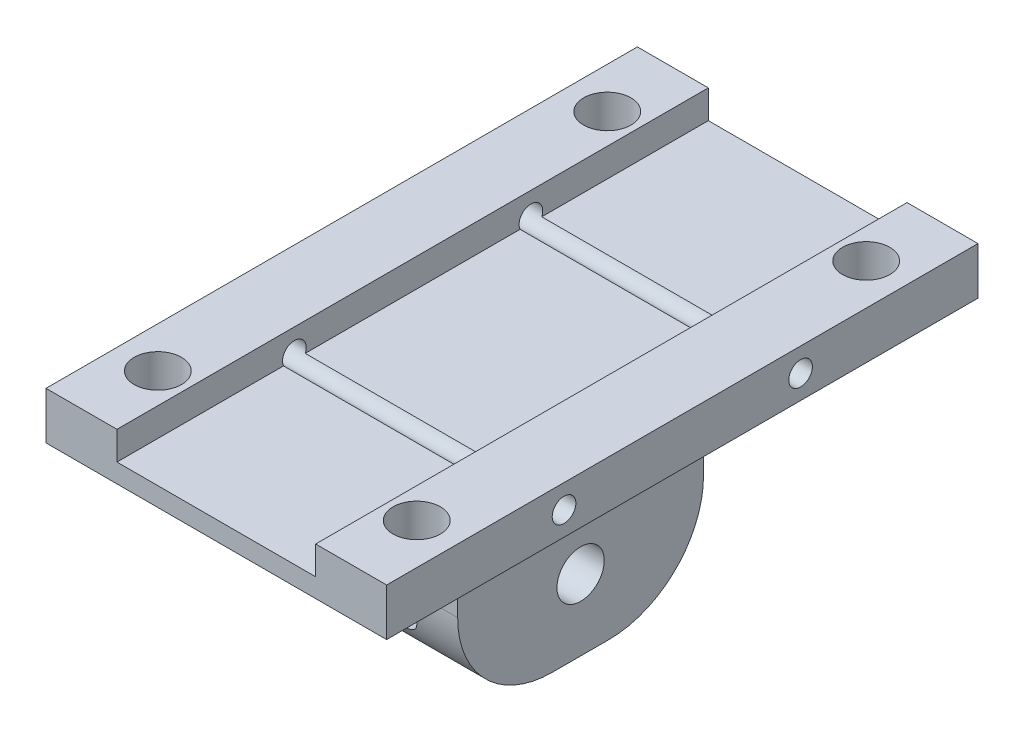
from build123d import *

# Parameters (mm, degrees)
SKETCH1_W               = 51.961524228
SKETCH1_H               = 30
SKETCH1_R               = 5
BOSS_EXTRUDE1_DEPTH     = 14.5
SKETCH2_W               = 29
SKETCH2_H               = 51.961524228
BOSS_EXTRUDE2_DEPTH     = 15
SKETCH3_W               = 72
SKETCH3_H               = 125
SKETCH3_R               = 5
BOSS_EXTRUDE3_DEPTH     = 10
FILLET1_R               = 20
CUT_EXTRUDE1_DEPTH      = 83.475754013
CUT_EXTRUDE1_DEPTH_BACK = 83.475754013
SKETCH4_R               = 5
CUT_EXTRUDE2_DEPTH      = 137.091880728
CUT_EXTRUDE2_DEPTH_BACK = 137.091880728
SKETCH5_W               = 42
SKETCH5_H               = 6
CUT_EXTRUDE3_DEPTH      = 104.393665183
CUT_EXTRUDE3_DEPTH_BACK = 104.393665183
SKETCH6_R               = 2.5


with BuildPart() as part:
    # Sketch1 → Boss-Extrude1 (new, symmetric)
    with BuildSketch(Plane(origin=(0, 0, 0), x_dir=(0, 0, -1), z_dir=(1, 0, 0))):
        Rectangle(SKETCH1_W, SKETCH1_H)
        with Locations(Location((0, 0, 0), (0, 0, 180))):
            Circle(SKETCH1_R, mode=Mode.SUBTRACT)
    extrude(amount=BOSS_EXTRUDE1_DEPTH, both=True)

    # Sketch2 → Boss-Extrude2 (add)
    with BuildSketch(Plane(origin=(0, 15, 0), x_dir=(1, 0, 0), z_dir=(0, 1, 0))):
        Rectangle(SKETCH2_W, SKETCH2_H)
    extrude(amount=BOSS_EXTRUDE2_DEPTH)

    # Sketch3 → Boss-Extrude3 (add)
    with BuildSketch(Plane(origin=(0, 30, 0), x_dir=(1, 0, 0), z_dir=(0, 1, 0))):
        Rectangle(SKETCH3_W, SKETCH3_H)
        with Locations(Location((-27.36, 47.5, 0), (0, 0, 270))):
            Circle(SKETCH3_R, mode=Mode.SUBTRACT)
        with Locations(Location((27.36, 47.5, 0), (0, 0, 270))):
            Circle(SKETCH3_R, mode=Mode.SUBTRACT)
        with Locations(Location((-27.36, -47.5, 0), (0, 0, 270))):
            Circle(SKETCH3_R, mode=Mode.SUBTRACT)
        with Locations(Location((27.36, -47.5, 0), (0, 0, 270))):
            Circle(SKETCH3_R, mode=Mode.SUBTRACT)
    extrude(amount=BOSS_EXTRUDE3_DEPTH)

    # Fillet1
    fillet1_edges = [part.edges().sort_by_distance(p)[0] for p in [
        (0, -15, 25.980762114),
        (0, -15, -25.980762114),
    ]]
    fillet(fillet1_edges, radius=FILLET1_R)

    # Sketch4 → Cut-Extrude1 (cut, two sides: drawn at the far end of the back side and taken through both)
    with BuildSketch(Plane.XY.offset(-CUT_EXTRUDE1_DEPTH_BACK)):
        with Locations(Location((0, 0, 0), (0, 0, 90))):
            Circle(SKETCH4_R)
    extrude(amount=CUT_EXTRUDE1_DEPTH + CUT_EXTRUDE1_DEPTH_BACK, mode=Mode.SUBTRACT)

    # Sketch5 → Cut-Extrude2 (cut, two sides: drawn at the far end of the back side and taken through both)
    with BuildSketch(Plane.XY.offset(62.5).offset(-CUT_EXTRUDE2_DEPTH_BACK)):
        with Locations((0, 37)):
            Rectangle(SKETCH5_W, SKETCH5_H)
    extrude(amount=CUT_EXTRUDE2_DEPTH + CUT_EXTRUDE2_DEPTH_BACK, mode=Mode.SUBTRACT)

    # Sketch6 → Cut-Extrude3 (cut, two sides: drawn at the far end of the back side and taken through both)
    with BuildSketch(Plane(origin=(36, 0, 0), x_dir=(0, 0, -1), z_dir=(1, 0, 0)).offset(-CUT_EXTRUDE3_DEPTH_BACK)):
        with Locations((-25, 35)):
            Circle(SKETCH6_R)
        with Locations((25, 35)):
            Circle(SKETCH6_R)
    extrude(amount=CUT_EXTRUDE3_DEPTH + CUT_EXTRUDE3_DEPTH_BACK, mode=Mode.SUBTRACT)


solid = part.part
